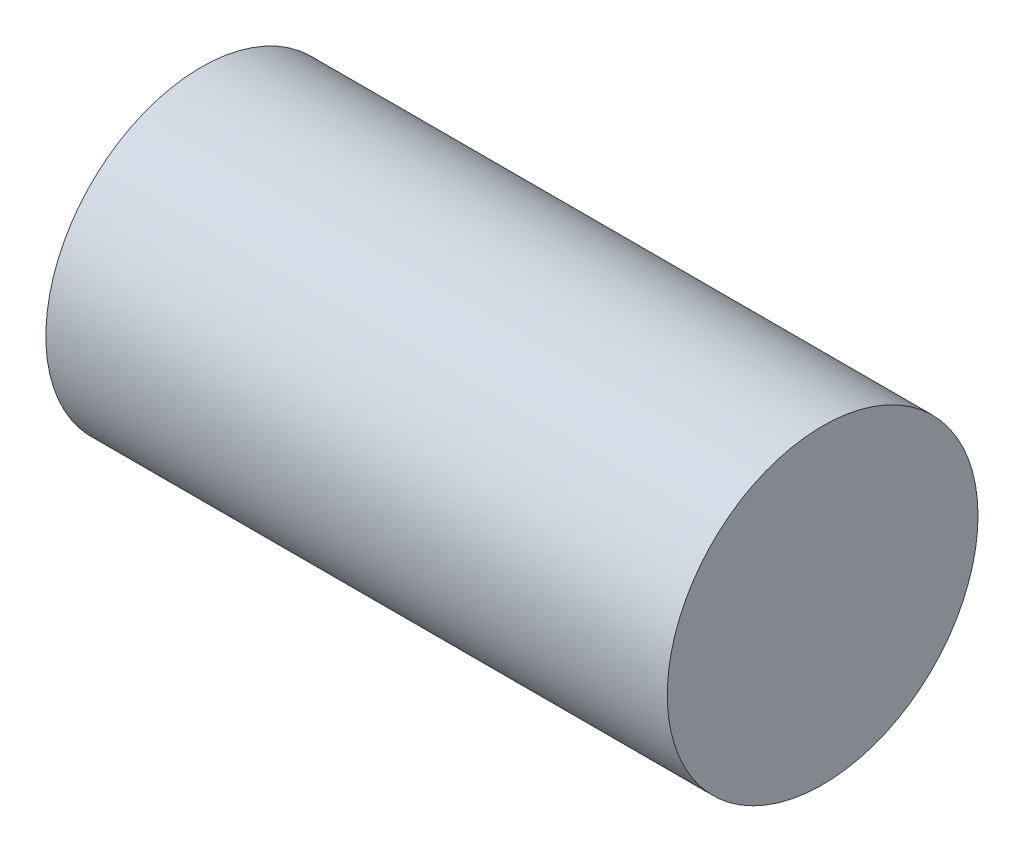
from build123d import *

# Parameters (mm, degrees)
SKETCH1_R           = 20
BOSS_EXTRUDE1_DEPTH = 80


with BuildPart() as part:
    # Sketch1 → Boss-Extrude1 (new body)
    with BuildSketch(Plane(origin=(0, 0, 0), x_dir=(0, 0, -1), z_dir=(1, 0, 0))):
        Circle(SKETCH1_R)
    extrude(amount=BOSS_EXTRUDE1_DEPTH)


solid = part.part
